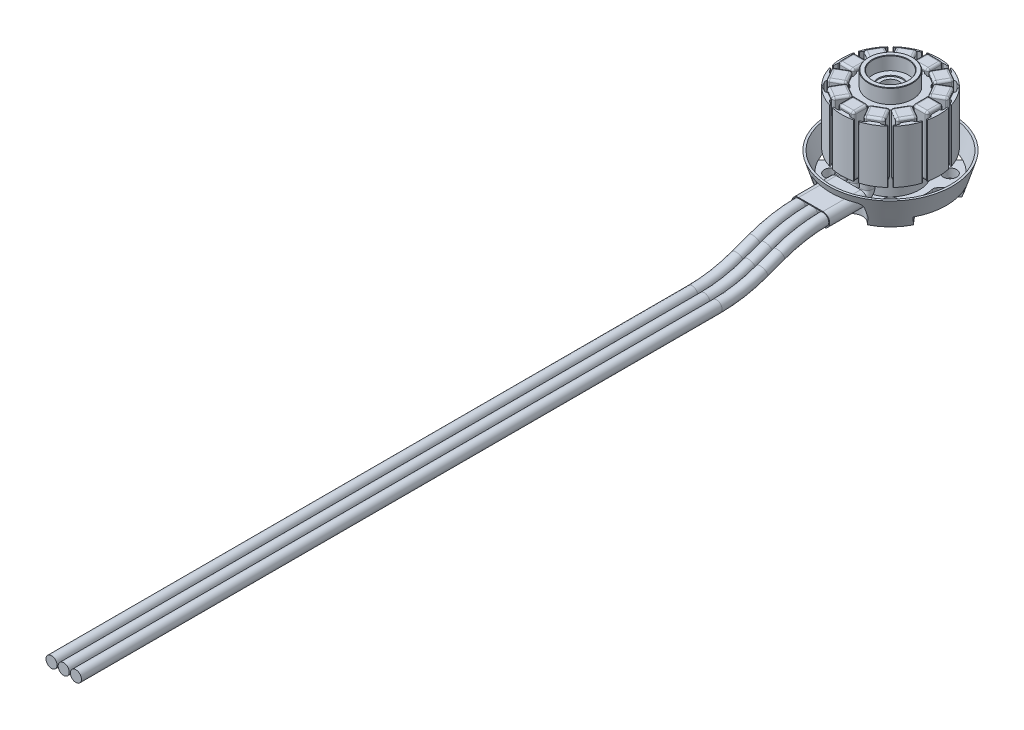
from build123d import *
from build123d.topology import SkipClean

# Parameters (mm, degrees)
SKETCH6_R                = 1.5
CUT_EXTRUDE1_DEPTH       = 2
CUT_EXTRUDE3_DEPTH       = 5
SKETCH11_R               = 5
BOSS_EXTRUDE2_DEPTH      = 12
SKETCH12_W               = 3.56
SKETCH12_H               = 13.56
SKETCH12_W_2             = 2
SKETCH12_H_2             = 12
BOSS_EXTRUDE3_DEPTH      = 3.4
FILLET2_R                = 0.5
CIRPATTERN3_COUNT        = 12
FILLET2_OF_CIRPATTERN3_R = 0.5
SKETCH13_R               = 1.25
BOSS_EXTRUDE4_DEPTH      = 8.5


with BuildPart() as part:
    # Sketch1 → Revolve1 (revolve)
    with BuildSketch(Plane.XY):
        Polygon((4, 0), (12, 0), (14, 6.5), (13.5, 6.5), (12.115384615, 2), (6.5, 2), (6.5, 7), (5, 7), (5, 22.15), (4.9, 22.25), (4.1, 22.25), (4, 22.15), (4, 19.25), (2.75, 19.25), (2.75, 19), (2, 19), (2, 3.35), (2.1, 3.25), (2.75, 3.25), (2.75, 3.1), (2.85, 3), (4, 3), align=None)
    revolve(axis=Axis((0, -5, 0), (0, 1, 0)))

    # Sketch6 → Cut-Extrude1 (cut)
    with BuildSketch(Plane.XZ):
        with Locations((-6.717514421, 6.717514421)):
            Circle(SKETCH6_R)
        with Locations((5.656854249, 5.656854249)):
            Circle(SKETCH6_R)
        with Locations((6.717514421, -6.717514421)):
            Circle(SKETCH6_R)
        with Locations((-5.656854249, -5.656854249)):
            Circle(SKETCH6_R)
        with BuildLine():
            Line((-7.114141594, 12.057735665), (-4.876744388, 10.139966631))
            ThreePointArc((-4.876744388, 10.139966631), (-2.216864232, 9.76146279), (-0.749899231, 12.012294034))
            Line((-0.749899231, 12.012294034), (0, 12))
            Line((0, 12), (0.749899231, 12.012294034))
            ThreePointArc((0.749899231, 12.012294034), (2.216864232, 9.76146279), (4.876744388, 10.139966631))
            Line((4.876744388, 10.139966631), (7.114141594, 12.057735665))
            ThreePointArc((7.114141594, 12.057735665), (0, 14), (-7.114141594, 12.057735665))
        make_face()
        with BuildLine():
            Line((12.057735665, 7.114141594), (8.059227919, 2.449215891))
            ThreePointArc((8.059227919, 2.449215891), (7.850500024, 2.049434504), (7.838652908, 1.598599571))
            ThreePointArc((7.838652908, 1.598599571), (8, 0), (7.838652908, -1.598599571))
            ThreePointArc((7.838652908, -1.598599571), (7.850500024, -2.049434504), (8.059227919, -2.449215891))
            Line((8.059227919, -2.449215891), (12.057735665, -7.114141594))
            ThreePointArc((12.057735665, -7.114141594), (14, 0), (12.057735665, 7.114141594))
        make_face()
        with BuildLine():
            Line((7.114141594, -12.057735665), (2.449215891, -8.059227919))
            ThreePointArc((2.449215891, -8.059227919), (2.049434504, -7.850500024), (1.598599571, -7.838652908))
            ThreePointArc((1.598599571, -7.838652908), (0, -8), (-1.598599571, -7.838652908))
            ThreePointArc((-1.598599571, -7.838652908), (-2.049434504, -7.850500024), (-2.449215891, -8.059227919))
            Line((-2.449215891, -8.059227919), (-7.114141594, -12.057735665))
            ThreePointArc((-7.114141594, -12.057735665), (0, -14), (7.114141594, -12.057735665))
        make_face()
        with BuildLine():
            Line((-12.057735665, -7.114141594), (-8.059227919, -2.449215891))
            ThreePointArc((-8.059227919, -2.449215891), (-7.850500024, -2.049434504), (-7.838652908, -1.598599571))
            ThreePointArc((-7.838652908, -1.598599571), (-8, 0), (-7.838652908, 1.598599571))
            ThreePointArc((-7.838652908, 1.598599571), (-7.850500024, 2.049434504), (-8.059227919, 2.449215891))
            Line((-8.059227919, 2.449215891), (-12.057735665, 7.114141594))
            ThreePointArc((-12.057735665, 7.114141594), (-14, 0), (-12.057735665, -7.114141594))
        make_face()
    extrude(amount=-CUT_EXTRUDE1_DEPTH, mode=Mode.SUBTRACT)

    # Sketch10 → Cut-Extrude3 (cut)
    with BuildSketch(Plane(origin=(6.213203436, 0, 15.35967893), x_dir=(1, 0, 0), z_dir=(0, 0, 1))):
        with BuildLine():
            Line((-12.209229805, 2), (-0.217177066, 2))
            Line((-0.217177066, 2), (-0.217177066, 4.000002632))
            ThreePointArc((-0.217177066, 4.000002632), (-0.510070285, 4.707109413), (-1.217177066, 5.000002632))
            Line((-1.217177066, 5.000002632), (-11.209229805, 5.000002632))
            ThreePointArc((-11.209229805, 5.000002632), (-11.916336586, 4.707109413), (-12.209229805, 4.000002632))
            Line((-12.209229805, 4.000002632), (-12.209229805, 2))
        make_face()
    extrude(amount=-CUT_EXTRUDE3_DEPTH, mode=Mode.SUBTRACT)



with BuildPart() as body_2:
    # Sketch11 → Boss-Extrude2 (new body)
    with BuildSketch(Plane(origin=(0, 7, 0), x_dir=(1, 0, 0), z_dir=(0, 1, 0))):
        with BuildLine():
            Line((-1, 10), (-1, 6.837397166))
            ThreePointArc((-1, 6.837397166), (-1.110403139, 6.52400558), (-1.392857143, 6.349011654))
            ThreePointArc((-1.392857143, 6.349011654), (-1.682323793, 6.278517871), (-1.968256157, 6.194833953))
            ThreePointArc((-1.968256157, 6.194833953), (-2.300365464, 6.205156136), (-2.552673179, 6.421359641))
            Line((-2.552673179, 6.421359641), (-4.133974596, 9.160254038))
            ThreePointArc((-4.133974596, 9.160254038), (-4.183924807, 9.53966356), (-3.950961894, 9.84326674))
            Line((-3.950961894, 9.84326674), (-3.242202699, 10.252469052))
            ThreePointArc((-3.242202699, 10.252469052), (-3.190372763, 10.411256035), (-3.342687788, 10.479810988))
            ThreePointArc((-3.342687788, 10.479810988), (-5.5, 9.526279442), (-7.404438649, 8.134758035))
            ThreePointArc((-7.404438649, 8.134758035), (-7.42122583, 7.968571878), (-7.257797301, 7.934064428))
            Line((-7.257797301, 7.934064428), (-6.549038106, 8.34326674))
            ThreePointArc((-6.549038106, 8.34326674), (-6.169628583, 8.393216951), (-5.866025404, 8.160254038))
            Line((-5.866025404, 8.160254038), (-4.284723987, 5.421359641))
            ThreePointArc((-4.284723987, 5.421359641), (-4.223640117, 5.094752998), (-4.380755496, 4.80197681))
            ThreePointArc((-4.380755496, 4.80197681), (-4.596194078, 4.596194078), (-4.80197681, 4.380755496))
            ThreePointArc((-4.80197681, 4.380755496), (-5.094752998, 4.223640117), (-5.421359641, 4.284723987))
            Line((-5.421359641, 4.284723987), (-8.160254038, 5.866025404))
            ThreePointArc((-8.160254038, 5.866025404), (-8.393216951, 6.169628583), (-8.34326674, 6.549038106))
            Line((-8.34326674, 6.549038106), (-7.934064428, 7.257797301))
            ThreePointArc((-7.934064428, 7.257797301), (-7.968571878, 7.42122583), (-8.134758035, 7.404438649))
            ThreePointArc((-8.134758035, 7.404438649), (-9.526279442, 5.5), (-10.479810988, 3.342687788))
            ThreePointArc((-10.479810988, 3.342687788), (-10.411256035, 3.190372763), (-10.252469052, 3.242202699))
            Line((-10.252469052, 3.242202699), (-9.84326674, 3.950961894))
            ThreePointArc((-9.84326674, 3.950961894), (-9.53966356, 4.183924807), (-9.160254038, 4.133974596))
            Line((-9.160254038, 4.133974596), (-6.421359641, 2.552673179))
            ThreePointArc((-6.421359641, 2.552673179), (-6.205156136, 2.300365464), (-6.194833953, 1.968256157))
            ThreePointArc((-6.194833953, 1.968256157), (-6.278517871, 1.682323793), (-6.349011654, 1.392857143))
            ThreePointArc((-6.349011654, 1.392857143), (-6.52400558, 1.110403139), (-6.837397166, 1))
            Line((-6.837397166, 1), (-10, 1))
            ThreePointArc((-10, 1), (-10.353553391, 1.146446609), (-10.5, 1.5))
            Line((-10.5, 1.5), (-10.5, 2.318404624))
            ThreePointArc((-10.5, 2.318404624), (-10.611598593, 2.442684157), (-10.747126437, 2.345052953))
            ThreePointArc((-10.747126437, 2.345052953), (-11, 0), (-10.747126437, -2.345052953))
            ThreePointArc((-10.747126437, -2.345052953), (-10.611598593, -2.442684157), (-10.5, -2.318404624))
            Line((-10.5, -2.318404624), (-10.5, -1.5))
            ThreePointArc((-10.5, -1.5), (-10.353553391, -1.146446609), (-10, -1))
            Line((-10, -1), (-6.837397166, -1))
            ThreePointArc((-6.837397166, -1), (-6.52400558, -1.110403139), (-6.349011654, -1.392857143))
            ThreePointArc((-6.349011654, -1.392857143), (-6.278517871, -1.682323793), (-6.194833953, -1.968256157))
            ThreePointArc((-6.194833953, -1.968256157), (-6.205156136, -2.300365464), (-6.421359641, -2.552673179))
            Line((-6.421359641, -2.552673179), (-9.160254038, -4.133974596))
            ThreePointArc((-9.160254038, -4.133974596), (-9.53966356, -4.183924807), (-9.84326674, -3.950961894))
            Line((-9.84326674, -3.950961894), (-10.252469052, -3.242202699))
            ThreePointArc((-10.252469052, -3.242202699), (-10.411256035, -3.190372763), (-10.479810988, -3.342687788))
            ThreePointArc((-10.479810988, -3.342687788), (-9.526279442, -5.5), (-8.134758035, -7.404438649))
            ThreePointArc((-8.134758035, -7.404438649), (-7.968571878, -7.42122583), (-7.934064428, -7.257797301))
            Line((-7.934064428, -7.257797301), (-8.34326674, -6.549038106))
            ThreePointArc((-8.34326674, -6.549038106), (-8.393216951, -6.169628583), (-8.160254038, -5.866025404))
            Line((-8.160254038, -5.866025404), (-5.421359641, -4.284723987))
            ThreePointArc((-5.421359641, -4.284723987), (-5.094752998, -4.223640117), (-4.80197681, -4.380755496))
            ThreePointArc((-4.80197681, -4.380755496), (-4.596194078, -4.596194078), (-4.380755496, -4.80197681))
            ThreePointArc((-4.380755496, -4.80197681), (-4.223640117, -5.094752998), (-4.284723987, -5.421359641))
            Line((-4.284723987, -5.421359641), (-5.866025404, -8.160254038))
            ThreePointArc((-5.866025404, -8.160254038), (-6.169628583, -8.393216951), (-6.549038106, -8.34326674))
            Line((-6.549038106, -8.34326674), (-7.257797301, -7.934064428))
            ThreePointArc((-7.257797301, -7.934064428), (-7.42122583, -7.968571878), (-7.404438649, -8.134758035))
            ThreePointArc((-7.404438649, -8.134758035), (-5.5, -9.526279442), (-3.342687788, -10.479810988))
            ThreePointArc((-3.342687788, -10.479810988), (-3.190372763, -10.411256035), (-3.242202699, -10.252469052))
            Line((-3.242202699, -10.252469052), (-3.950961894, -9.84326674))
            ThreePointArc((-3.950961894, -9.84326674), (-4.183924807, -9.53966356), (-4.133974596, -9.160254038))
            Line((-4.133974596, -9.160254038), (-2.552673179, -6.421359641))
            ThreePointArc((-2.552673179, -6.421359641), (-2.300365464, -6.205156136), (-1.968256157, -6.194833953))
            ThreePointArc((-1.968256157, -6.194833953), (-1.682323793, -6.278517871), (-1.392857143, -6.349011654))
            ThreePointArc((-1.392857143, -6.349011654), (-1.110403139, -6.52400558), (-1, -6.837397166))
            Line((-1, -6.837397166), (-1, -10))
            ThreePointArc((-1, -10), (-1.146446609, -10.353553391), (-1.5, -10.5))
            Line((-1.5, -10.5), (-2.318404624, -10.5))
            ThreePointArc((-2.318404624, -10.5), (-2.442684157, -10.611598593), (-2.345052953, -10.747126437))
            ThreePointArc((-2.345052953, -10.747126437), (0, -11), (2.345052953, -10.747126437))
            ThreePointArc((2.345052953, -10.747126437), (2.442684157, -10.611598593), (2.318404624, -10.5))
            Line((2.318404624, -10.5), (1.5, -10.5))
            ThreePointArc((1.5, -10.5), (1.146446609, -10.353553391), (1, -10))
            Line((1, -10), (1, -6.837397166))
            ThreePointArc((1, -6.837397166), (1.110403139, -6.52400558), (1.392857143, -6.349011654))
            ThreePointArc((1.392857143, -6.349011654), (1.682323793, -6.278517871), (1.968256157, -6.194833953))
            ThreePointArc((1.968256157, -6.194833953), (2.300365464, -6.205156136), (2.552673179, -6.421359641))
            Line((2.552673179, -6.421359641), (4.133974596, -9.160254038))
            ThreePointArc((4.133974596, -9.160254038), (4.183924807, -9.53966356), (3.950961894, -9.84326674))
            Line((3.950961894, -9.84326674), (3.242202699, -10.252469052))
            ThreePointArc((3.242202699, -10.252469052), (3.190372763, -10.411256035), (3.342687788, -10.479810988))
            ThreePointArc((3.342687788, -10.479810988), (5.5, -9.526279442), (7.404438649, -8.134758035))
            ThreePointArc((7.404438649, -8.134758035), (7.42122583, -7.968571878), (7.257797301, -7.934064428))
            Line((7.257797301, -7.934064428), (6.549038106, -8.34326674))
            ThreePointArc((6.549038106, -8.34326674), (6.169628583, -8.393216951), (5.866025404, -8.160254038))
            Line((5.866025404, -8.160254038), (4.284723987, -5.421359641))
            ThreePointArc((4.284723987, -5.421359641), (4.223640117, -5.094752998), (4.380755496, -4.80197681))
            ThreePointArc((4.380755496, -4.80197681), (4.596194078, -4.596194078), (4.80197681, -4.380755496))
            ThreePointArc((4.80197681, -4.380755496), (5.094752998, -4.223640117), (5.421359641, -4.284723987))
            Line((5.421359641, -4.284723987), (8.160254038, -5.866025404))
            ThreePointArc((8.160254038, -5.866025404), (8.393216951, -6.169628583), (8.34326674, -6.549038106))
            Line((8.34326674, -6.549038106), (7.934064428, -7.257797301))
            ThreePointArc((7.934064428, -7.257797301), (7.968571878, -7.42122583), (8.134758035, -7.404438649))
            ThreePointArc((8.134758035, -7.404438649), (9.526279442, -5.5), (10.479810988, -3.342687788))
            ThreePointArc((10.479810988, -3.342687788), (10.411256035, -3.190372763), (10.252469052, -3.242202699))
            Line((10.252469052, -3.242202699), (9.84326674, -3.950961894))
            ThreePointArc((9.84326674, -3.950961894), (9.53966356, -4.183924807), (9.160254038, -4.133974596))
            Line((9.160254038, -4.133974596), (6.421359641, -2.552673179))
            ThreePointArc((6.421359641, -2.552673179), (6.205156136, -2.300365464), (6.194833953, -1.968256157))
            ThreePointArc((6.194833953, -1.968256157), (6.278517871, -1.682323793), (6.349011654, -1.392857143))
            ThreePointArc((6.349011654, -1.392857143), (6.52400558, -1.110403139), (6.837397166, -1))
            Line((6.837397166, -1), (10, -1))
            ThreePointArc((10, -1), (10.353553391, -1.146446609), (10.5, -1.5))
            Line((10.5, -1.5), (10.5, -2.318404624))
            ThreePointArc((10.5, -2.318404624), (10.611598593, -2.442684157), (10.747126437, -2.345052953))
            ThreePointArc((10.747126437, -2.345052953), (11, 0), (10.747126437, 2.345052953))
            ThreePointArc((10.747126437, 2.345052953), (10.611598593, 2.442684157), (10.5, 2.318404624))
            Line((10.5, 2.318404624), (10.5, 1.5))
            ThreePointArc((10.5, 1.5), (10.353553391, 1.146446609), (10, 1))
            Line((10, 1), (6.837397166, 1))
            ThreePointArc((6.837397166, 1), (6.52400558, 1.110403139), (6.349011654, 1.392857143))
            ThreePointArc((6.349011654, 1.392857143), (6.278517871, 1.682323793), (6.194833953, 1.968256157))
            ThreePointArc((6.194833953, 1.968256157), (6.205156136, 2.300365464), (6.421359641, 2.552673179))
            Line((6.421359641, 2.552673179), (9.160254038, 4.133974596))
            ThreePointArc((9.160254038, 4.133974596), (9.53966356, 4.183924807), (9.84326674, 3.950961894))
            Line((9.84326674, 3.950961894), (10.252469052, 3.242202699))
            ThreePointArc((10.252469052, 3.242202699), (10.411256035, 3.190372763), (10.479810988, 3.342687788))
            ThreePointArc((10.479810988, 3.342687788), (9.526279442, 5.5), (8.134758035, 7.404438649))
            ThreePointArc((8.134758035, 7.404438649), (7.968571878, 7.42122583), (7.934064428, 7.257797301))
            Line((7.934064428, 7.257797301), (8.34326674, 6.549038106))
            ThreePointArc((8.34326674, 6.549038106), (8.393216951, 6.169628583), (8.160254038, 5.866025404))
            Line((8.160254038, 5.866025404), (5.421359641, 4.284723987))
            ThreePointArc((5.421359641, 4.284723987), (5.094752998, 4.223640117), (4.80197681, 4.380755496))
            ThreePointArc((4.80197681, 4.380755496), (4.596194078, 4.596194078), (4.380755496, 4.80197681))
            ThreePointArc((4.380755496, 4.80197681), (4.223640117, 5.094752998), (4.284723987, 5.421359641))
            Line((4.284723987, 5.421359641), (5.866025404, 8.160254038))
            ThreePointArc((5.866025404, 8.160254038), (6.169628583, 8.393216951), (6.549038106, 8.34326674))
            Line((6.549038106, 8.34326674), (7.257797301, 7.934064428))
            ThreePointArc((7.257797301, 7.934064428), (7.42122583, 7.968571878), (7.404438649, 8.134758035))
            ThreePointArc((7.404438649, 8.134758035), (5.5, 9.526279442), (3.342687788, 10.479810988))
            ThreePointArc((3.342687788, 10.479810988), (3.190372763, 10.411256035), (3.242202699, 10.252469052))
            Line((3.242202699, 10.252469052), (3.950961894, 9.84326674))
            ThreePointArc((3.950961894, 9.84326674), (4.183924807, 9.53966356), (4.133974596, 9.160254038))
            Line((4.133974596, 9.160254038), (2.552673179, 6.421359641))
            ThreePointArc((2.552673179, 6.421359641), (2.300365464, 6.205156136), (1.968256157, 6.194833953))
            ThreePointArc((1.968256157, 6.194833953), (1.682323793, 6.278517871), (1.392857143, 6.349011654))
            ThreePointArc((1.392857143, 6.349011654), (1.110403139, 6.52400558), (1, 6.837397166))
            Line((1, 6.837397166), (1, 10))
            ThreePointArc((1, 10), (1.146446609, 10.353553391), (1.5, 10.5))
            Line((1.5, 10.5), (2.318404624, 10.5))
            ThreePointArc((2.318404624, 10.5), (2.442684157, 10.611598593), (2.345052953, 10.747126437))
            ThreePointArc((2.345052953, 10.747126437), (0, 11), (-2.345052953, 10.747126437))
            ThreePointArc((-2.345052953, 10.747126437), (-2.442684157, 10.611598593), (-2.318404624, 10.5))
            Line((-2.318404624, 10.5), (-1.5, 10.5))
            ThreePointArc((-1.5, 10.5), (-1.146446609, 10.353553391), (-1, 10))
        make_face()
        Circle(SKETCH11_R, mode=Mode.SUBTRACT)
    extrude(amount=BOSS_EXTRUDE2_DEPTH)


with BuildPart() as part_1:
    with SkipClean():  # the faces are left unmerged after this step: merging them gives an invalid solid
        add(part.part)

        add(body_2.part)  # Boss-Extrude3 merges body 2
        # Sketch12 → Boss-Extrude3 (add)
        with BuildSketch(Plane.XY.offset(6.7)):
            with Locations((0, 13)):
                Rectangle(SKETCH12_W, SKETCH12_H)
            with Locations((0, 13)):
                Rectangle(SKETCH12_W_2, SKETCH12_H_2, mode=Mode.SUBTRACT)
        boss_extrude3 = extrude(amount=BOSS_EXTRUDE3_DEPTH)

    # Fillet2
    fillet2_edges = [part_1.edges().sort_by_distance(p)[0] for p in [
        (-1.78, 6.22, 8.4),
        (0, 6.22, 10.1),
        (1.78, 6.22, 8.4),
        (0, 6.22, 6.7),
        (1.78, 19.78, 8.4),
        (0, 19.78, 10.1),
        (-1.78, 19.78, 8.4),
        (0, 19.78, 6.7),
        (-1.78, 13, 6.7),
        (-1.78, 13, 10.1),
        (1.78, 13, 6.7),
        (1.78, 13, 10.1),
    ]]
    fillet(fillet2_edges, radius=FILLET2_R)

    # CirPattern3: Boss-Extrude3 ×12 about axis
    cirpattern3_axis = Axis((0, 19, 0), (0, -1, 0))
    for i in range(1, CIRPATTERN3_COUNT):
        add(boss_extrude3.rotate(cirpattern3_axis, i * 360 / CIRPATTERN3_COUNT))

    # Fillet2 of CirPattern3
    fillet2_of_cirpattern3_edges = [part_1.edges().sort_by_distance(p)[0] for p in [
        (-5.741525219, 6.22, 6.384613392),
        (-5.05, 6.22, 8.746856578),
        (-2.658474781, 6.22, 8.164613392),
        (-3.35, 6.22, 5.802370205),
        (-2.658474781, 19.78, 8.164613392),
        (-5.05, 19.78, 8.746856578),
        (-5.741525219, 19.78, 6.384613392),
        (-3.35, 19.78, 5.802370205),
        (-4.891525219, 13, 4.912370205),
        (-6.591525219, 13, 7.856856578),
        (-1.808474781, 13, 6.692370205),
        (-3.508474781, 13, 9.636856578),
        (-8.164613392, 6.22, 2.658474781),
        (-8.746856578, 6.22, 5.05),
        (-6.384613392, 6.22, 5.741525219),
        (-5.802370205, 6.22, 3.35),
        (-6.384613392, 19.78, 5.741525219),
        (-8.746856578, 19.78, 5.05),
        (-8.164613392, 19.78, 2.658474781),
        (-5.802370205, 19.78, 3.35),
        (-6.692370205, 13, 1.808474781),
        (-9.636856578, 13, 3.508474781),
        (-4.912370205, 13, 4.891525219),
        (-7.856856578, 13, 6.591525219),
        (-8.4, 6.22, -1.78),
        (-10.1, 6.22, 0),
        (-8.4, 6.22, 1.78),
        (-6.7, 6.22, 0),
        (-8.4, 19.78, 1.78),
        (-10.1, 19.78, 0),
        (-8.4, 19.78, -1.78),
        (-6.7, 19.78, 0),
        (-6.7, 13, -1.78),
        (-10.1, 13, -1.78),
        (-6.7, 13, 1.78),
        (-10.1, 13, 1.78),
        (-6.384613392, 6.22, -5.741525219),
        (-8.746856578, 6.22, -5.05),
        (-8.164613392, 6.22, -2.658474781),
        (-5.802370205, 6.22, -3.35),
        (-8.164613392, 19.78, -2.658474781),
        (-8.746856578, 19.78, -5.05),
        (-6.384613392, 19.78, -5.741525219),
        (-5.802370205, 19.78, -3.35),
        (-4.912370205, 13, -4.891525219),
        (-7.856856578, 13, -6.591525219),
        (-6.692370205, 13, -1.808474781),
        (-9.636856578, 13, -3.508474781),
        (-2.658474781, 6.22, -8.164613392),
        (-5.05, 6.22, -8.746856578),
        (-5.741525219, 6.22, -6.384613392),
        (-3.35, 6.22, -5.802370205),
        (-5.741525219, 19.78, -6.384613392),
        (-5.05, 19.78, -8.746856578),
        (-2.658474781, 19.78, -8.164613392),
        (-3.35, 19.78, -5.802370205),
        (-1.808474781, 13, -6.692370205),
        (-3.508474781, 13, -9.636856578),
        (-4.891525219, 13, -4.912370205),
        (-6.591525219, 13, -7.856856578),
        (1.78, 6.22, -8.4),
        (0, 6.22, -10.1),
        (-1.78, 6.22, -8.4),
        (0, 6.22, -6.7),
        (-1.78, 19.78, -8.4),
        (0, 19.78, -10.1),
        (1.78, 19.78, -8.4),
        (0, 19.78, -6.7),
        (1.78, 13, -6.7),
        (1.78, 13, -10.1),
        (-1.78, 13, -6.7),
        (-1.78, 13, -10.1),
        (5.741525219, 6.22, -6.384613392),
        (5.05, 6.22, -8.746856578),
        (2.658474781, 6.22, -8.164613392),
        (3.35, 6.22, -5.802370205),
        (2.658474781, 19.78, -8.164613392),
        (5.05, 19.78, -8.746856578),
        (5.741525219, 19.78, -6.384613392),
        (3.35, 19.78, -5.802370205),
        (4.891525219, 13, -4.912370205),
        (6.591525219, 13, -7.856856578),
        (1.808474781, 13, -6.692370205),
        (3.508474781, 13, -9.636856578),
        (8.164613392, 6.22, -2.658474781),
        (8.746856578, 6.22, -5.05),
        (6.384613392, 6.22, -5.741525219),
        (5.802370205, 6.22, -3.35),
        (6.384613392, 19.78, -5.741525219),
        (8.746856578, 19.78, -5.05),
        (8.164613392, 19.78, -2.658474781),
        (5.802370205, 19.78, -3.35),
        (6.692370205, 13, -1.808474781),
        (9.636856578, 13, -3.508474781),
        (4.912370205, 13, -4.891525219),
        (7.856856578, 13, -6.591525219),
        (8.4, 6.22, 1.78),
        (10.1, 6.22, 0),
        (8.4, 6.22, -1.78),
        (6.7, 6.22, 0),
        (8.4, 19.78, -1.78),
        (10.1, 19.78, 0),
        (8.4, 19.78, 1.78),
        (6.7, 19.78, 0),
        (6.7, 13, 1.78),
        (10.1, 13, 1.78),
        (6.7, 13, -1.78),
        (10.1, 13, -1.78),
        (6.384613392, 6.22, 5.741525219),
        (8.746856578, 6.22, 5.05),
        (8.164613392, 6.22, 2.658474781),
        (5.802370205, 6.22, 3.35),
        (8.164613392, 19.78, 2.658474781),
        (8.746856578, 19.78, 5.05),
        (6.384613392, 19.78, 5.741525219),
        (5.802370205, 19.78, 3.35),
        (4.912370205, 13, 4.891525219),
        (7.856856578, 13, 6.591525219),
        (6.692370205, 13, 1.808474781),
        (9.636856578, 13, 3.508474781),
        (2.658474781, 6.22, 8.164613392),
        (5.05, 6.22, 8.746856578),
        (5.741525219, 6.22, 6.384613392),
        (3.35, 6.22, 5.802370205),
        (5.741525219, 19.78, 6.384613392),
        (5.05, 19.78, 8.746856578),
        (2.658474781, 19.78, 8.164613392),
        (3.35, 19.78, 5.802370205),
        (1.808474781, 13, 6.692370205),
        (3.508474781, 13, 9.636856578),
        (4.891525219, 13, 4.912370205),
        (6.591525219, 13, 7.856856578),
    ]]
    fillet(fillet2_of_cirpattern3_edges, radius=FILLET2_OF_CIRPATTERN3_R)


with BuildPart() as body_2_2:
    # Sweep2: sweep along a curve in space
    with BuildLine() as sweep2_path:
        Line((0, 6, 8), (0, 4.9, 8))
        ThreePointArc((0, 4.9, 8), (0, 3.839339828, 8.439339828), (0, 3.4, 9.5))
        Line((0, 3.4, 9.5), (0, 3.4, 17.710190579))
        ThreePointArc((0, 3.4, 17.710190579), (0, 2.94423259, 22.919635909), (0, 1.590778624, 27.970794879))
        Line((0, 1.590778624, 27.970794879), (0, 0.209221376, 31.766592219))
        ThreePointArc((0, 0.209221376, 31.766592219), (0, -1.14423259, 36.817751189), (0, -1.6, 42.027196519))
        Line((0, -1.6, 42.027196519), (0, -1.6, 186.737387097))
    # Sketch13 → Sweep2 (sweep)
    with BuildSketch(Plane(origin=(0, 6, 0), x_dir=(1, 0, 0), z_dir=(0, 1, 0))):
        with Locations((0, -8)):
            Circle(SKETCH13_R)
        with Locations((2.75, -8)):
            Circle(SKETCH13_R)
        with Locations((-2.75, -8)):
            Circle(SKETCH13_R)
    sweep(path=sweep2_path.line)


with BuildPart() as body_3:
    # Sketch14 → Boss-Extrude4 (new body)
    with BuildSketch(Plane.XY.offset(18)):
        with BuildLine():
            Line((-2.75, 4.912440475), (2.75, 4.912440475))
            ThreePointArc((2.75, 4.912440475), (4.262440475, 3.4), (2.75, 1.887559525))
            Line((2.75, 1.887559525), (-2.75, 1.887559525))
            ThreePointArc((-2.75, 1.887559525), (-4.262440475, 3.4), (-2.75, 4.912440475))
        make_face()
        with BuildLine():
            Line((-2.75, 4.712440475), (2.75, 4.712440475))
            ThreePointArc((2.75, 4.712440475), (4.062440475, 3.4), (2.75, 2.087559525))
            Line((2.75, 2.087559525), (-2.75, 2.087559525))
            ThreePointArc((-2.75, 2.087559525), (-4.062440475, 3.4), (-2.75, 4.712440475))
        make_face(mode=Mode.SUBTRACT)
    extrude(amount=-BOSS_EXTRUDE4_DEPTH)


solid = Compound([part_1.part, body_2_2.part, body_3.part])
